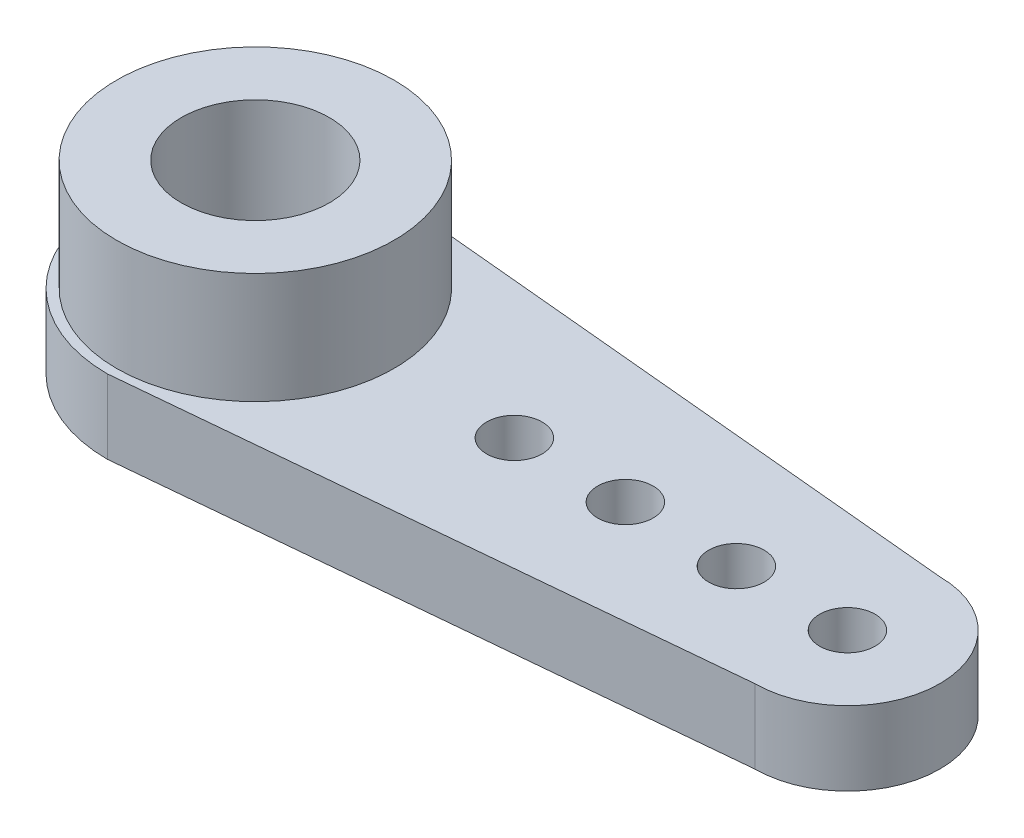
from build123d import *

# Parameters (mm, degrees)
ESQUISSE1_R        = 0.75
ESQUISSE1_R_2      = 1
BOSS_EXTRU_1_DEPTH = 2
ESQUISSE2_R        = 3.75
ESQUISSE2_R_2      = 2
BOSS_EXTRU_2_DEPTH = 3


with BuildPart() as part:
    # Esquisse1 → Boss.-Extru.1 (new body)
    with BuildSketch(Plane(origin=(0, 0, 0), x_dir=(1, 0, 0), z_dir=(0, 1, 0))):
        with BuildLine():
            Line((0, 4), (16, 2.5))
            ThreePointArc((16, 2.5), (18.5, 0), (16, -2.5))
            Line((16, -2.5), (0, -4))
            ThreePointArc((0, -4), (-4, 0), (0, 4))
        make_face()
        with Locations(Location((16, 0, 0), (0, 0, 270))):
            Circle(ESQUISSE1_R, mode=Mode.SUBTRACT)
        with Locations(Location((13, 0, 0), (0, 0, 270))):
            Circle(ESQUISSE1_R, mode=Mode.SUBTRACT)
        with Locations(Location((10, 0, 0), (0, 0, 270))):
            Circle(ESQUISSE1_R, mode=Mode.SUBTRACT)
        with Locations(Location((7, 0, 0), (0, 0, 270))):
            Circle(ESQUISSE1_R, mode=Mode.SUBTRACT)
        with Locations(Location((0, 0, 0), (0, 0, 270))):
            Circle(ESQUISSE1_R_2, mode=Mode.SUBTRACT)
    extrude(amount=BOSS_EXTRU_1_DEPTH)

    # Esquisse2 → Boss.-Extru.2 (add)
    with BuildSketch(Plane(origin=(0, 2, 0), x_dir=(1, 0, 0), z_dir=(0, 1, 0))):
        with Locations(Location((0, 0, 0), (0, 0, 270))):
            Circle(ESQUISSE2_R)
        with Locations(Location((0, 0, 0), (0, 0, 270))):
            Circle(ESQUISSE2_R_2, mode=Mode.SUBTRACT)
    extrude(amount=BOSS_EXTRU_2_DEPTH)


solid = part.part
